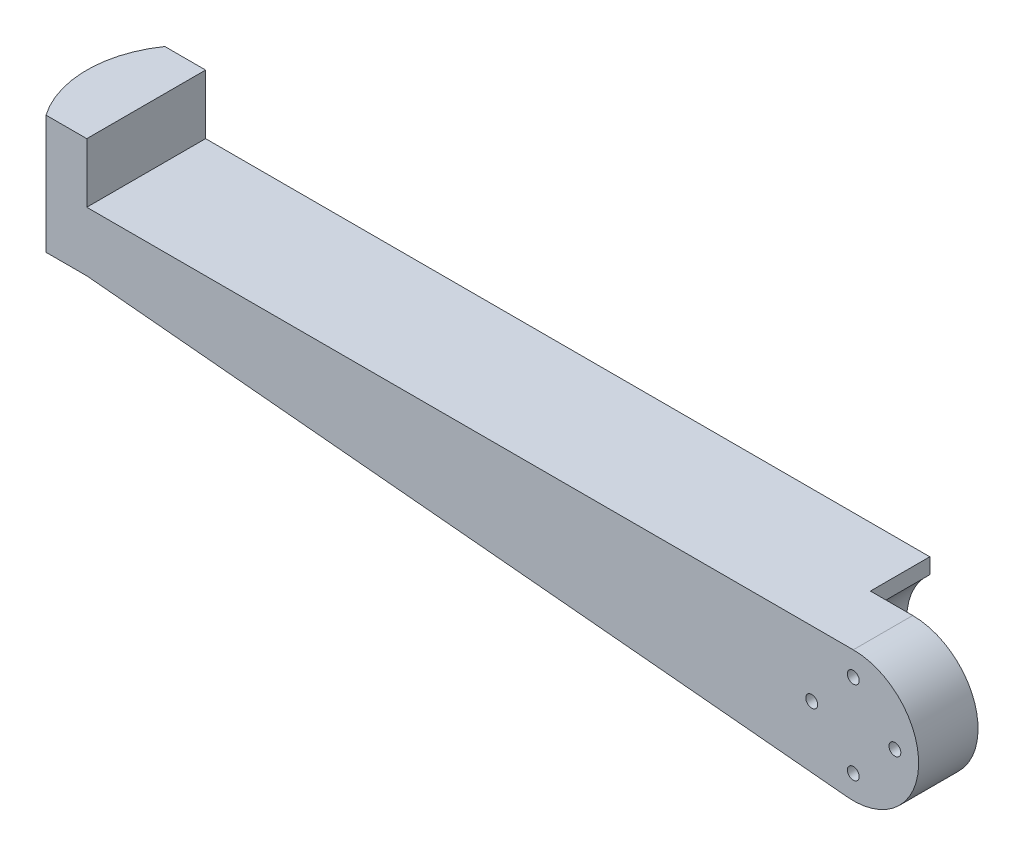
from build123d import *

# Parameters (mm, degrees)
SKETCH1_R           = 11
SKETCH1_R_2         = 1
BOSS_EXTRUDE1_DEPTH = 10
BOSS_EXTRUDE2_START = -20
BOSS_EXTRUDE2_DEPTH = 20
CUT_EXTRUDE2_DEPTH  = 10
CUT_EXTRUDE3_DEPTH  = 20


with BuildPart() as part:
    # Sketch1 → Boss-Extrude1 (new body)
    with BuildSketch(Plane.XY):
        Circle(SKETCH1_R)
        with Locations((0, 7)):
            Circle(SKETCH1_R_2, mode=Mode.SUBTRACT)
        with Locations((7, 0)):
            Circle(SKETCH1_R_2, mode=Mode.SUBTRACT)
        with Locations((0, -7)):
            Circle(SKETCH1_R_2, mode=Mode.SUBTRACT)
        with Locations((-7, 0)):
            Circle(SKETCH1_R_2, mode=Mode.SUBTRACT)
    extrude(amount=BOSS_EXTRUDE1_DEPTH)

    # Sketch2 → Boss-Extrude2 (add)
    with BuildSketch(Plane.XY.offset(10).offset(BOSS_EXTRUDE2_START)):
        with BuildLine():
            Line((0, 11), (-129, 11))
            Line((-129, 11), (-129, 21))
            Line((-129, 21), (-139, 21))
            Line((-139, 21), (-139, 1))
            Line((-139, 1), (-129, 1))
            Line((-129, 1), (-1.02288634, -10.952337811))
            ThreePointArc((-1.02288634, -10.952337811), (-10.988077992, 0.511998083), (0, 11))
        make_face()
    extrude(amount=BOSS_EXTRUDE2_DEPTH)

    # Sketch3 → Cut-Extrude2 (cut)
    with BuildSketch(Plane(origin=(0, 0, -10), x_dir=(-1, 0, 0), z_dir=(0, 0, -1))):
        with BuildLine():
            Line((0, 11), (7.12256812, 11))
            Line((7.12256812, 11), (7.12256812, 8.382662069))
            ThreePointArc((7.12256812, 8.382662069), (3.794121587, 10.324952367), (0, 11))
        make_face()
        with BuildLine():
            Line((7.12256812, -8.382662069), (7.12256812, -10.382662069))
            Line((7.12256812, -10.382662069), (1.02288634, -10.952337811))
            ThreePointArc((1.02288634, -10.952337811), (4.270587248, -10.137163536), (7.12256812, -8.382662069))
        make_face()
    extrude(amount=-CUT_EXTRUDE2_DEPTH, mode=Mode.SUBTRACT)

    # Sketch4 → Cut-Extrude3 (cut)
    with BuildSketch(Plane(origin=(0, 21, 0), x_dir=(1, 0, 0), z_dir=(0, 1, 0))):
        with BuildLine():
            Line((-135.861406616, 10), (-139, 10))
            Line((-139, 10), (-139, 0))
            ThreePointArc((-139, 0), (-138.196925103, 5.240485866), (-135.861406616, 10))
        make_face()
    cut_extrude3 = extrude(amount=-CUT_EXTRUDE3_DEPTH, mode=Mode.SUBTRACT)

    # Mirror1: Cut-Extrude3 across plane
    add(cut_extrude3.mirror(Plane.XY), mode=Mode.SUBTRACT)


solid = part.part
